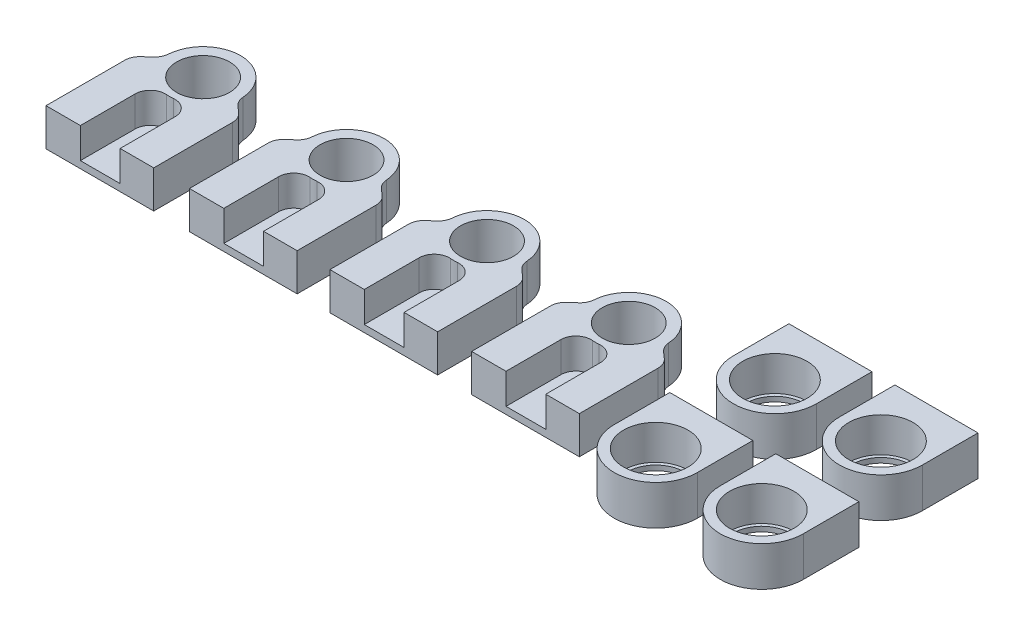
from build123d import *

# Parameters (mm, degrees)
SKETCH1_R           = 8.4925
BOSS_EXTRUDE1_DEPTH = 12
SKETCH2_R           = 2.5
CUT_EXTRUDE1_DEPTH  = 10.5
CUT_EXTRUDE2_DEPTH  = 20
FILLET1_R           = 4.85
BOSS_EXTRUDE2_START = 15.12
SKETCH4_R           = 2.5
BOSS_EXTRUDE2_DEPTH = 15.12
BOSS_EXTRUDE3_DEPTH = 2.25
SKETCH6_R           = 3.764318711
SKETCH6_R_2         = 3.822228058
BOSS_EXTRUDE4_DEPTH = 28
SKETCH7_R           = 9.25
BOSS_EXTRUDE5_DEPTH = 12.7
SKETCH9_R           = 10.3125
CUT_EXTRUDE3_DEPTH  = 11.11


with BuildPart() as part:
    # Sketch1 → Boss-Extrude1 (new body)
    with BuildSketch(Plane(origin=(0, 0, 0), x_dir=(1, 0, 0), z_dir=(0, 1, 0))):
        with BuildLine():
            Line((-11.9925, 0), (-11.9925, -1))
            Line((-11.9925, -1), (-17.273214818, -5.680223499))
            Line((-17.273214818, -5.680223499), (-17.273214818, -17.9925))
            Line((-17.273214818, -17.9925), (-16, -17.9925))
            Line((-16, -17.9925), (16, -17.9925))
            Line((16, -17.9925), (17.273214818, -17.9925))
            Line((17.273214818, -17.9925), (17.273214818, -5.680223499))
            Line((17.273214818, -5.680223499), (11.9925, -1))
            Line((11.9925, -1), (11.9925, 0))
            ThreePointArc((11.9925, 0), (0, 11.9925), (-11.9925, 0))
        make_face()
        with Locations(Location((0, 0, 0), (0, 0, 270))):
            Circle(SKETCH1_R, mode=Mode.SUBTRACT)
    extrude(amount=BOSS_EXTRUDE1_DEPTH)

    # Sketch2 → Cut-Extrude1 (cut)
    with BuildSketch(Plane.XY.offset(17.9925)):
        with Locations((-11.811421167, 6)):
            Circle(SKETCH2_R)
        with Locations((11.811421167, 6)):
            Circle(SKETCH2_R)
    extrude(amount=-CUT_EXTRUDE1_DEPTH, mode=Mode.SUBTRACT)

    # Sketch3 → Cut-Extrude2 (cut)
    with BuildSketch(Plane(origin=(0, 12, 0), x_dir=(1, 0, 0), z_dir=(0, 1, 0))):
        with BuildLine():
            Line((-6.25, -17.9925), (-6.25, -8.73720815))
            ThreePointArc((-6.25, -8.73720815), (0.155311434, -10.741377221), (6.5, -8.55285369))
            Line((6.5, -8.55285369), (6.5, -17.9925))
            Line((6.5, -17.9925), (-6.25, -17.9925))
        make_face()
    extrude(amount=-CUT_EXTRUDE2_DEPTH, mode=Mode.SUBTRACT)

    # Fillet1
    fillet1_edges = [part.edges().sort_by_distance(p)[0] for p in [
        (6.5, 6, 8.55285369),
        (-6.25, 6, 8.73720815),
        (-17.273214818, 6, 5.680223499),
        (-11.9925, 6, 1),
        (11.9925, 6, 1),
        (17.273214818, 6, 5.680223499),
    ]]
    fillet(fillet1_edges, radius=FILLET1_R)

    # Sketch4 → Boss-Extrude2 (add)
    # profile 1 of 2: a face of its own
    with BuildSketch(Plane.XY.offset(17.9925).offset(BOSS_EXTRUDE2_START)):
        Polygon((6.5, 12), (6.5, 0), (14.811421167, 0), (17.273214818, 0), (17.273214818, 2.5), (17.273214818, 9.5), (17.273214818, 12), (14.811421167, 12), align=None)
        with Locations((11.811421167, 6)):
            Circle(SKETCH4_R, mode=Mode.SUBTRACT)
    # profile 2 of 2: a face of its own
    with BuildSketch(Plane.XY.offset(17.9925).offset(BOSS_EXTRUDE2_START)):
        Polygon((-14.811421167, 0), (-6.25, 0), (-6.25, 12), (-14.811421167, 12), (-17.273214818, 12), (-17.273214818, 9.5), (-17.273214818, 2.5), (-17.273214818, 0), align=None)
        with Locations((-11.811421167, 6)):
            Circle(SKETCH4_R, mode=Mode.SUBTRACT)
    extrude(amount=-BOSS_EXTRUDE2_DEPTH)


with BuildPart() as body_2:
    # Sketch5 → Boss-Extrude3 (new body)
    with BuildSketch(Plane.XZ):
        with BuildLine():
            Line((-6.25, 33.1125), (6.5, 33.1125))
            Line((6.5, 33.1125), (6.5, 15.504952636))
            ThreePointArc((6.5, 15.504952636), (4.892942072, 11.898593431), (1.136772487, 10.682183979))
            ThreePointArc((1.136772487, 10.682183979), (0.08653402, 10.742151466), (-0.964534231, 10.699111176))
            ThreePointArc((-0.964534231, 10.699111176), (-4.671887148, 11.949402747), (-6.25, 15.529522087))
            Line((-6.25, 15.529522087), (-6.25, 33.1125))
        make_face()
    extrude(amount=-BOSS_EXTRUDE3_DEPTH)

    # Combine1: union part
    add(part.part)

    # Sketch6 → Boss-Extrude4 (add)
    with BuildSketch(Plane.XY.offset(33.1125)):
        with Locations((-11.552199594, 5.873251729)):
            Circle(SKETCH6_R)
        with Locations((11.660840969, 5.583541394)):
            Circle(SKETCH6_R_2)
    extrude(amount=-BOSS_EXTRUDE4_DEPTH)


with BuildPart() as body_2_2:
    # Body-Move/Copy1: copy of body 2
    add(body_2.part.moved(Location((45.050849807, 0, 0))))


with BuildPart() as body_3:
    # Body-Move/Copy2: copy of body 2 2
    add(body_2_2.part.moved(Location((45.448487886, 0, 0))))


with BuildPart() as body_4:
    # Sketch7 → Boss-Extrude5 (new body)
    with BuildSketch(Plane(origin=(0, 0, 0), x_dir=(1, 0, 0), z_dir=(0, 1, 0))):
        with BuildLine():
            Line((114.617746977, 6.934477983), (114.617746977, 20.253227983))
            Line((114.617746977, 20.253227983), (114.617746977, 24.753227983))
            Line((114.617746977, 24.753227983), (141.255246977, 24.753227983))
            Line((141.255246977, 24.753227983), (141.255246977, 20.253227983))
            Line((141.255246977, 20.253227983), (141.255246977, 6.934477983))
            ThreePointArc((141.255246977, 6.934477983), (127.936496977, -6.384272017), (114.617746977, 6.934477983))
        make_face()
        with Locations(Location((127.936496977, 6.934477983, 0), (0, 0, 270))):
            Circle(SKETCH7_R, mode=Mode.SUBTRACT)
    extrude(amount=BOSS_EXTRUDE5_DEPTH)

    # Sketch9 → Cut-Extrude3 (cut)
    with BuildSketch(Plane(origin=(0, 12.7, 0), x_dir=(1, 0, 0), z_dir=(0, 1, 0))):
        with Locations(Location((127.936496977, 6.934477983, 0), (0, 0, 270))):
            Circle(SKETCH9_R)
    extrude(amount=-CUT_EXTRUDE3_DEPTH, mode=Mode.SUBTRACT)


with BuildPart() as body_5:
    # Body-Move/Copy3: copy of body 4
    add(body_4.part.moved(Location((0, 0, 38.204193649))))


with BuildPart() as body_6:
    # Body-Move/Copy4: copy of body 5
    add(body_5.part.moved(Location((34, 0, 0))))


with BuildPart() as body_7:
    # Body-Move/Copy5: copy of body 4
    add(body_4.part.moved(Location((34, 0, 0))))


with BuildPart() as body_7_1:
    # Body-Move/Copy6: moved
    add(body_7.part.moved(Location((2.5, 0, 0))))


with BuildPart() as body_5_1:
    # Body-Move/Copy6: moved
    add(body_5.part.moved(Location((2.5, 0, 0))))


with BuildPart() as body_6_1:
    # Body-Move/Copy6: moved
    add(body_6.part.moved(Location((2.5, 0, 0))))


with BuildPart() as body_4_1:
    # Body-Move/Copy6: moved
    add(body_4.part.moved(Location((2.5, 0, 0))))


with BuildPart() as body_8:
    # Body-Move/Copy7: copy of body 2
    add(body_2.part.moved(Location((-46, 0, 0))))


solid = Compound([body_2.part, body_2_2.part, body_3.part, body_7_1.part, body_5_1.part, body_6_1.part, body_4_1.part, body_8.part])
